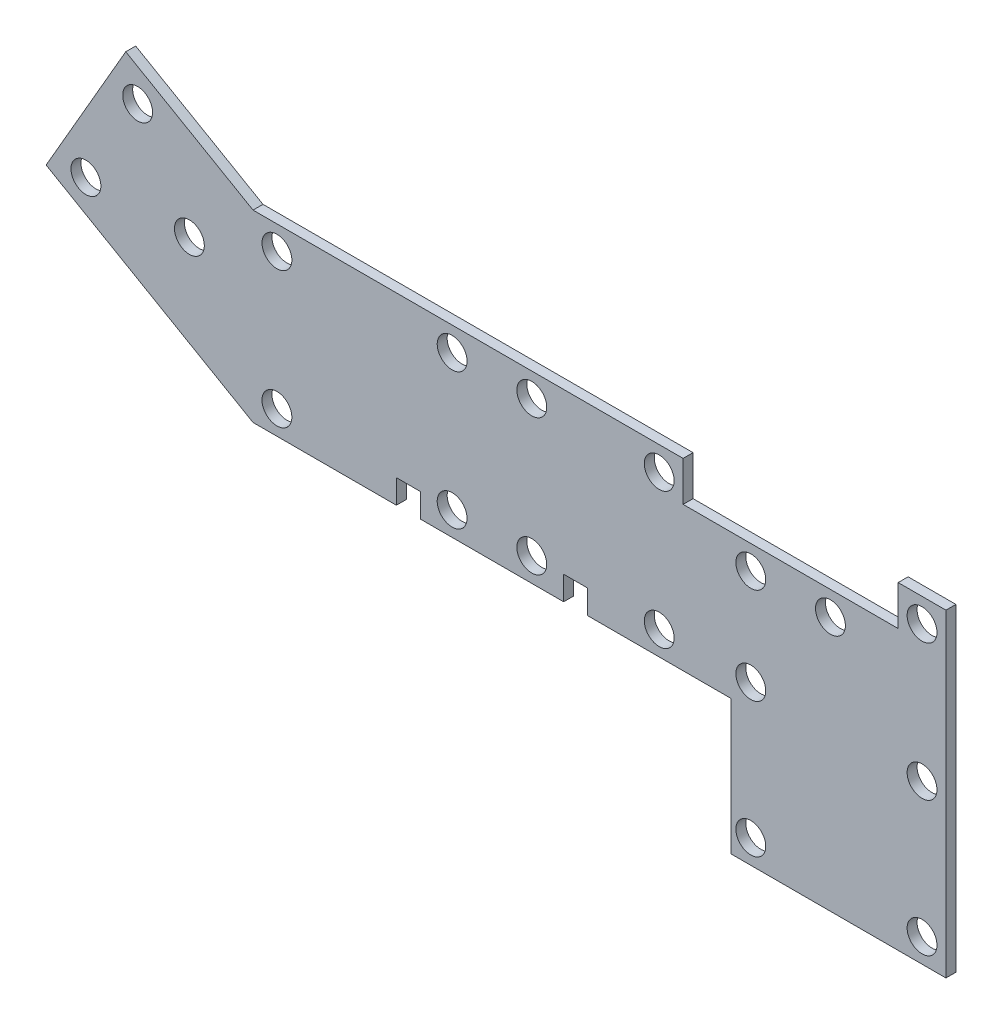
from build123d import *

# Parameters (mm, degrees)
SKETCH1_R           = 4.7625
BOSS_EXTRUDE1_DEPTH = 3.175


with BuildPart() as part:
    # Sketch1 → Boss-Extrude1 (new body)
    with BuildSketch(Plane.XY):
        Polygon((0, 0), (-40.591135768, 23.435303163), (-65.991135768, -20.55878735), (0, -58.65878735), (45.72, -58.65878735), (45.72, -51.03878735), (53.34, -51.03878735), (53.34, -58.65878735), (99.06, -58.65878735), (99.06, -51.03878735), (106.68, -51.03878735), (106.68, -58.65878735), (152.4, -58.65878735), (152.4, -101.6), (220.98, -101.6), (220.98, 0), (205.74, 0), (205.74, -12.7), (137.16, -12.7), (137.16, 0), (99.06, 0), align=None)
        with Locations((-20.295567884, -17.611742094)):
            Circle(SKETCH1_R, mode=Mode.SUBTRACT)
        with Locations((-53.291135768, -17.611742094)):
            Circle(SKETCH1_R, mode=Mode.SUBTRACT)
        with Locations((-36.793351826, 10.963257906)):
            Circle(SKETCH1_R, mode=Mode.SUBTRACT)
        with Locations((7.62, -51.03878735)):
            Circle(SKETCH1_R, mode=Mode.SUBTRACT)
        with Locations((7.62, -7.62)):
            Circle(SKETCH1_R, mode=Mode.SUBTRACT)
        with Locations((63.5, -7.62)):
            Circle(SKETCH1_R, mode=Mode.SUBTRACT)
        with Locations((88.9, -7.62)):
            Circle(SKETCH1_R, mode=Mode.SUBTRACT)
        with Locations((129.54, -7.62)):
            Circle(SKETCH1_R, mode=Mode.SUBTRACT)
        with Locations((88.9, -51.03878735)):
            Circle(SKETCH1_R, mode=Mode.SUBTRACT)
        with Locations((63.5, -51.03878735)):
            Circle(SKETCH1_R, mode=Mode.SUBTRACT)
        with Locations((129.54, -51.03878735)):
            Circle(SKETCH1_R, mode=Mode.SUBTRACT)
        with Locations((158.75, -20.32)):
            Circle(SKETCH1_R, mode=Mode.SUBTRACT)
        with Locations((184.15, -20.32)):
            Circle(SKETCH1_R, mode=Mode.SUBTRACT)
        with Locations((213.36, -7.62)):
            Circle(SKETCH1_R, mode=Mode.SUBTRACT)
        with Locations((213.36, -93.98)):
            Circle(SKETCH1_R, mode=Mode.SUBTRACT)
        with Locations((158.75, -93.98)):
            Circle(SKETCH1_R, mode=Mode.SUBTRACT)
        with Locations((213.36, -51.03878735)):
            Circle(SKETCH1_R, mode=Mode.SUBTRACT)
        with Locations((158.75, -51.03878735)):
            Circle(SKETCH1_R, mode=Mode.SUBTRACT)
    extrude(amount=BOSS_EXTRUDE1_DEPTH)


solid = part.part
